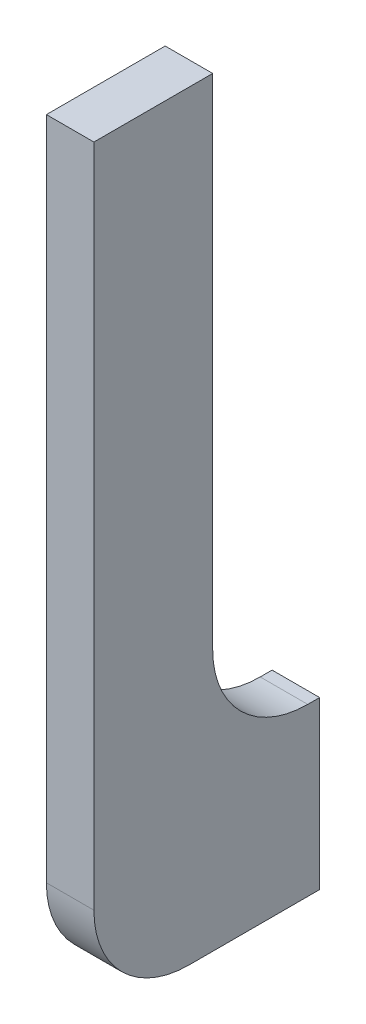
from build123d import *

# Parameters (mm, degrees)
BOSS_EXTRUDE1_DEPTH = 5
SKETCH2_W           = 2
SKETCH2_H           = 7.001972448
BOSS_EXTRUDE2_DEPTH = 4.5
FILLET1_R           = 4


with BuildPart() as part:
    # Sketch1 → Boss-Extrude1 (new body)
    with BuildSketch(Plane.XY):
        Polygon((0, 0), (0, 15), (2, 15), (2, 4.971605765), (2, -17), (0, -17), align=None)
    extrude(amount=BOSS_EXTRUDE1_DEPTH)

    # Sketch2 → Boss-Extrude2 (add)
    with BuildSketch(Plane(origin=(0, 0, 0), x_dir=(-1, 0, 0), z_dir=(0, 0, -1))):
        with Locations((-1, -13.499013776)):
            Rectangle(SKETCH2_W, SKETCH2_H)
    extrude(amount=BOSS_EXTRUDE2_DEPTH)

    # Fillet1
    fillet1_edges = [part.edges().sort_by_distance(p)[0] for p in [
        (1, -9.998027552, 0),
        (1, -17, 5),
    ]]
    fillet(fillet1_edges, radius=FILLET1_R)


solid = part.part
